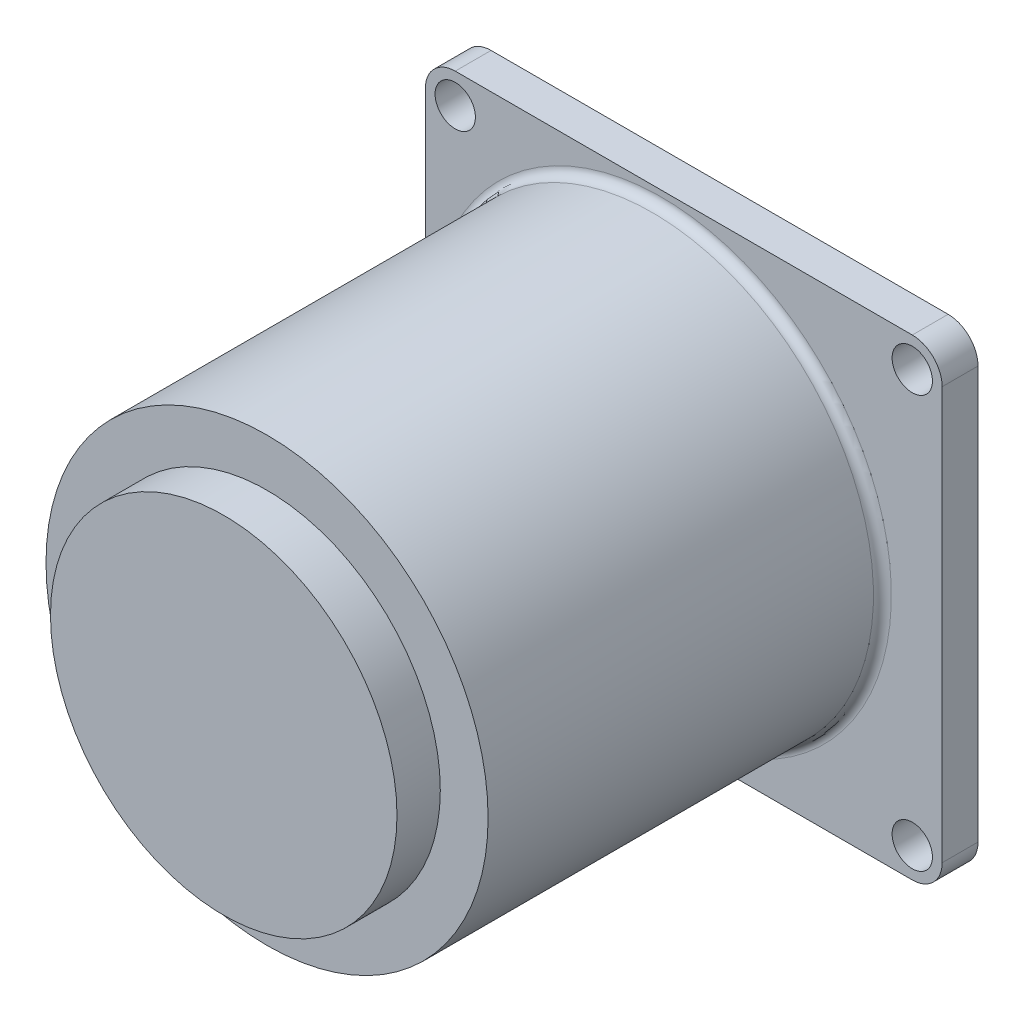
from build123d import *

# Parameters (mm, degrees)
SKIZZE1_W                       = 173
SKIZZE1_H                       = 158
AUFSATZ_LINEAR_AUSTRAGEN1_DEPTH = 12
VERRUNDUNG1_R                   = 10
SKIZZE2_R                       = 74
AUFSATZ_LINEAR_AUSTRAGEN2_DEPTH = 132
SKIZZE3_R                       = 58
AUFSATZ_LINEAR_AUSTRAGEN3_DEPTH = 14.5
SKIZZE4_R                       = 6.75
SCHNITT_LINEAR_AUSTRAGEN1_DEPTH = 12
VERRUNDUNG2_R                   = 3
SKALIEREN1_SCALE                = 2


with BuildPart() as part:
    # Skizze1 → Aufsatz-Linear austragen1 (new body)
    with BuildSketch(Plane.XY):
        with Locations((86.5, 79)):
            Rectangle(SKIZZE1_W, SKIZZE1_H)
    extrude(amount=AUFSATZ_LINEAR_AUSTRAGEN1_DEPTH)

    # Verrundung1
    verrundung1_edges = [part.edges().sort_by_distance(p)[0] for p in [
        (0, 158, 6),
        (173, 158, 6),
        (173, 0, 6),
        (0, 0, 6),
    ]]
    fillet(verrundung1_edges, radius=VERRUNDUNG1_R)

    # Skizze2 → Aufsatz-Linear austragen2 (add)
    with BuildSketch(Plane.XY.offset(12)):
        with Locations((79, 79)):
            Circle(SKIZZE2_R)
    extrude(amount=AUFSATZ_LINEAR_AUSTRAGEN2_DEPTH)

    # Skizze3 → Aufsatz-Linear austragen3 (add)
    with BuildSketch(Plane.XY.offset(144)):
        with Locations(Location((79, 79, 0), (0, 0, 180))):
            Circle(SKIZZE3_R)
    extrude(amount=AUFSATZ_LINEAR_AUSTRAGEN3_DEPTH)

    # Skizze4 → Schnitt-Linear austragen1 (cut)
    with BuildSketch(Plane(origin=(0, 0, 0), x_dir=(-1, 0, 0), z_dir=(0, 0, -1))):
        with Locations((-163, 148)):
            Circle(SKIZZE4_R)
        with Locations((-10, 148)):
            Circle(SKIZZE4_R)
        with Locations((-10, 10)):
            Circle(SKIZZE4_R)
        with Locations((-163, 10)):
            Circle(SKIZZE4_R)
    extrude(amount=-SCHNITT_LINEAR_AUSTRAGEN1_DEPTH, mode=Mode.SUBTRACT)

    # Verrundung2
    verrundung2_edges = [part.edges().sort_by_distance(p)[0] for p in [
        (5, 79, 12),
    ]]
    fillet(verrundung2_edges, radius=VERRUNDUNG2_R)


with BuildPart() as part_1:
    # Skalieren1: scaled about (0, 0, 0)
    add(part.part.scale(SKALIEREN1_SCALE))


solid = part_1.part
